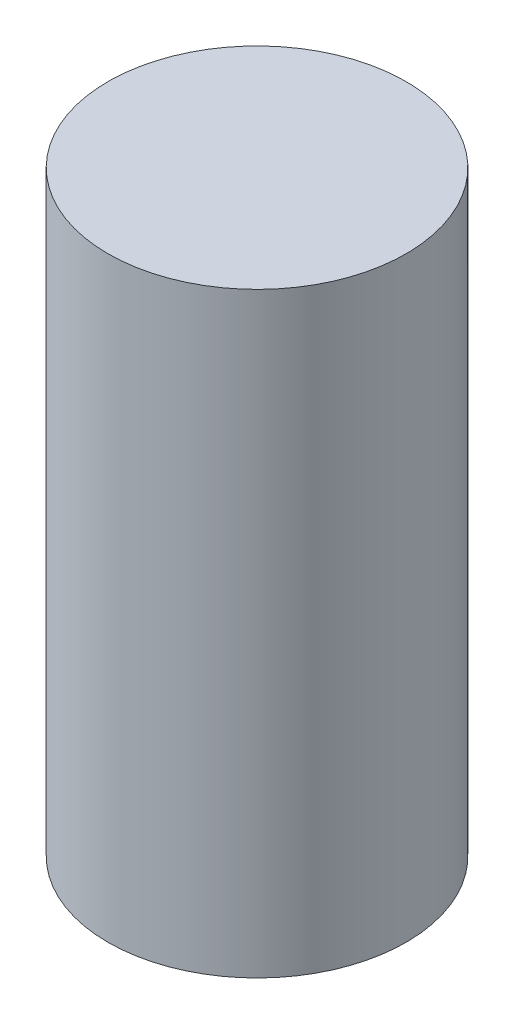
from build123d import *

# Parameters (mm, degrees)
SKETCH1_R           = 7.5
BOSS_EXTRUDE1_DEPTH = 30


with BuildPart() as part:
    # Sketch1 → Boss-Extrude1 (new body)
    with BuildSketch(Plane(origin=(0, 0, 0), x_dir=(1, 0, 0), z_dir=(0, 1, 0))):
        with Locations(Location((0, 0, 0), (0, 0, 270))):
            Circle(SKETCH1_R)
    extrude(amount=BOSS_EXTRUDE1_DEPTH)


solid = part.part
